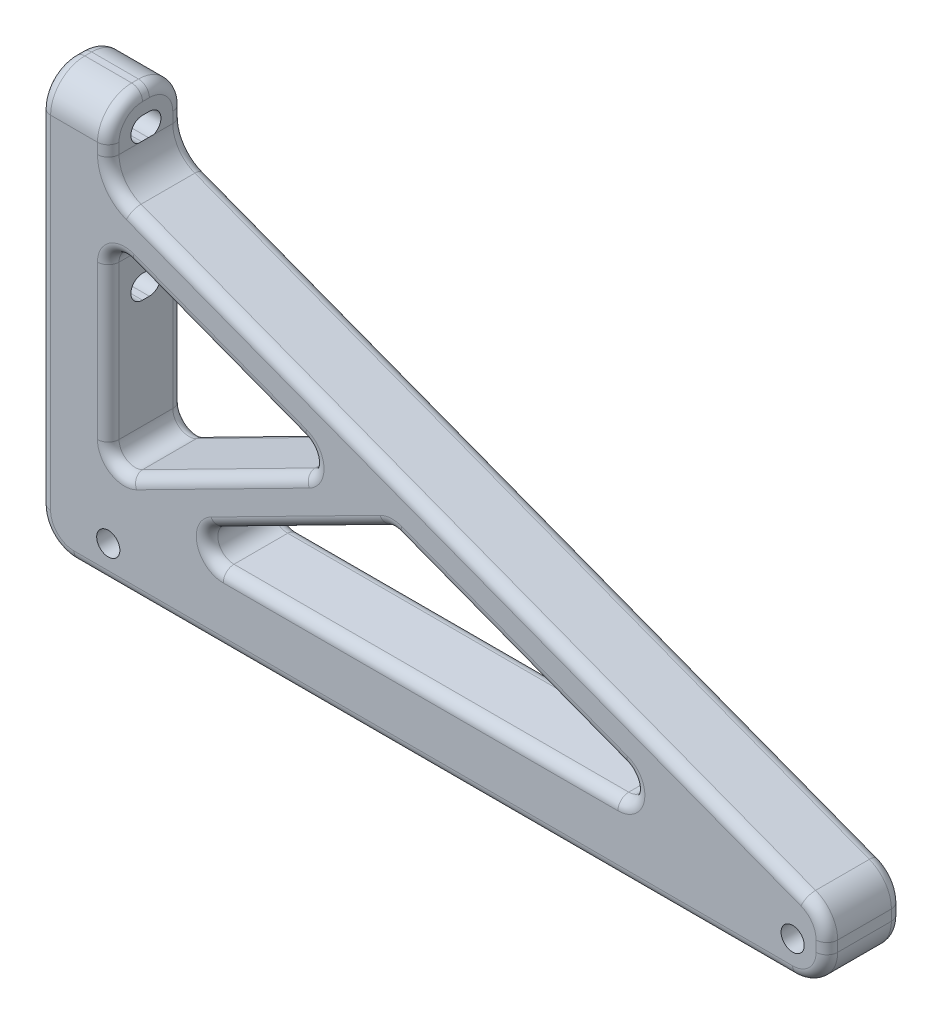
from build123d import *

# Parameters (mm, degrees)
SKETCH1_R           = 2.15
SKETCH1_W           = 12.7
SKETCH1_H           = 12.7
BOSS_EXTRUDE1_DEPTH = 13.97
FILLET1_R           = 3
FILLET2_R           = 6.35
CUT_EXTRUDE1_DEPTH  = 152.183351927
FILLET3_R           = 2
BOSS_EXTRUDE2_START = -13.97
SKETCH3_W           = 4.6228
SKETCH3_H           = 4.6228
BOSS_EXTRUDE2_DEPTH = 2
FILLET4_R           = 0.508


with BuildPart() as part:
    # Sketch1 → Boss-Extrude1 (new body)
    # profile 1 of 5: a face of its own
    with BuildSketch(Plane.XY):
        Polygon((0, 57.15), (-12.7, 57.15), (-12.7, -6.35), (133.35, -6.35), (133.35, 6.35), align=None)
        Circle(SKETCH1_R, mode=Mode.SUBTRACT)
        Polygon((0, 10.838020995), (0, 48.589159979), (42.42795548, 32.42612932), (47.471976934, 30.504597338), (52.515998389, 28.583065355), (110.877794946, 6.35), (8.820483578, 6.35), (0, 6.35), align=None, mode=Mode.SUBTRACT)
        with Locations((127, 0)):
            Circle(SKETCH1_R, mode=Mode.SUBTRACT)
    # profile 2 of 5: a face of its own
    with BuildSketch(Plane.XY):
        Polygon((133.35, 6.35), (0, 57.15), (-12.7, 57.15), (-12.7, -6.35), (133.35, -6.35), align=None)
        with Locations((127, 0)):
            Circle(SKETCH1_R, mode=Mode.SUBTRACT)
        Circle(SKETCH1_R, mode=Mode.SUBTRACT)
        Polygon((110.877794946, 6.35), (0, 48.589159979), (0, 6.35), align=None, mode=Mode.SUBTRACT)
    # profile 3 of 5: a face of its own
    with BuildSketch(Plane.XY):
        with Locations((-6.35, 63.5)):
            Rectangle(SKETCH1_W, SKETCH1_H)
    # profile 4 of 5: a face of its own
    with BuildSketch(Plane.XY):
        Polygon((42.42795548, 32.42612932), (0, 10.838020995), (0, 6.35), (47.471976934, 30.504597338), align=None)
    # profile 5 of 5: a face of its own
    with BuildSketch(Plane.XY):
        Polygon((47.471976934, 30.504597338), (0, 6.35), (8.820483578, 6.35), (52.515998389, 28.583065355), align=None)
    extrude(amount=BOSS_EXTRUDE1_DEPTH)

    # Fillet1
    fillet1_edges = [part.edges().sort_by_distance(p)[0] for p in [
        (52.515998389, 28.583065355, 6.985),
        (8.820483578, 6.35, 6.985),
        (110.877794946, 6.35, 6.985),
        (0, 48.589159979, 6.985),
        (0, 10.838020995, 6.985),
        (42.42795548, 32.42612932, 6.985),
    ]]
    fillet(fillet1_edges, radius=FILLET1_R)

    # Fillet2
    fillet2_edges = [part.edges().sort_by_distance(p)[0] for p in [
        (-6.35, 69.85, 0),
        (133.35, 6.35, 6.985),
        (133.35, -6.35, 6.985),
        (-12.7, -6.35, 6.985),
        (0, 57.15, 6.985),
        (-6.35, 69.85, 13.97),
    ]]
    fillet(fillet2_edges, radius=FILLET2_R)

    # Sketch2 → Cut-Extrude1 (cut, through all)
    with BuildSketch(Plane(origin=(0, 0, 0), x_dir=(0, 0, -1), z_dir=(1, 0, 0))):
        with BuildLine():
            Line((-7.62, 65.65), (-6.35, 65.65))
            ThreePointArc((-6.35, 65.65), (-4.2, 63.5), (-6.35, 61.35))
            Line((-6.35, 61.35), (-7.62, 61.35))
            ThreePointArc((-7.62, 61.35), (-9.77, 63.5), (-7.62, 65.65))
        make_face()
        with BuildLine():
            Line((-7.62, 35.95), (-6.35, 35.95))
            ThreePointArc((-6.35, 35.95), (-4.2, 38.1), (-6.35, 40.25))
            Line((-6.35, 40.25), (-7.62, 40.25))
            ThreePointArc((-7.62, 40.25), (-9.77, 38.1), (-7.62, 35.95))
        make_face()
    extrude(amount=-CUT_EXTRUDE1_DEPTH, mode=Mode.SUBTRACT)

    # Fillet3
    fillet3_edges = [part.edges().sort_by_distance(p)[0] for p in [
        (-12.7, 31.75, 13.97),
        (-12.7, 67.990128061, 12.110128061),
        (-12.7, 67.990128061, 1.859871939),
        (66.675, 31.75, 13.97),
        (60.325, -6.35, 13.97),
        (133.35, 0.986940426, 13.97),
        (132.22862896, 5.577204208, 13.97),
        (-10.840128061, -4.490128061, 13.97),
        (131.490128061, -4.490128061, 13.97),
        (1.12137104, 57.922795792, 0),
        (1.12137104, 57.922795792, 13.97),
        (57.953790951, 6.35, 0),
        (57.953790951, 6.35, 13.97),
        (74.701339099, 20.131506989, 0),
        (74.701339099, 20.131506989, 13.97),
        (35.65095639, 20.001828068, 0),
        (35.65095639, 20.001828068, 13.97),
        (0, 29.983239316, 0),
        (0, 29.983239316, 13.97),
        (20.378926173, 21.207185872, 0),
        (20.378926173, 21.207185872, 13.97),
        (20.086442529, 40.937181873, 0),
        (20.086442529, 40.937181873, 13.97),
        (97.526174762, 8.80704034, 0),
        (97.526174762, 8.80704034, 13.97),
        (52.531016852, 28.301819395, 0),
        (52.531016852, 28.301819395, 13.97),
        (18.414557487, 8.650483328, 0),
        (18.414557487, 8.650483328, 13.97),
        (1.431785869, 13.173010707, 0),
        (1.431785869, 13.173010707, 13.97),
        (38.032644918, 32.191420837, 0),
        (38.032644918, 32.191420837, 13.97),
        (1.297642509, 46.706206235, 0),
        (1.297642509, 46.706206235, 13.97),
        (66.675, 31.75, 0),
        (133.35, 0.986940426, 0),
        (60.325, -6.35, 0),
        (-12.7, 31.75, 0),
        (0, 62.513059574, 0),
        (132.22862896, 5.577204208, 0),
        (-10.840128061, -4.490128061, 0),
        (131.490128061, -4.490128061, 0),
        (0, 69.85, 6.985),
        (0, 62.513059574, 13.97),
        (0, 67.990128061, 12.110128061),
        (0, 67.990128061, 1.859871939),
        (-12.7, 69.85, 6.985),
    ]]
    fillet(fillet3_edges, radius=FILLET3_R)

    # Sketch3 → Boss-Extrude2 (add)
    with BuildSketch(Plane.XY.offset(13.97).offset(BOSS_EXTRUDE2_START)):
        with Locations((12.7, 0)):
            Rectangle(SKETCH3_W, SKETCH3_H)
        with Locations((114.3, 0)):
            Rectangle(SKETCH3_W, SKETCH3_H)
    extrude(amount=-BOSS_EXTRUDE2_DEPTH)

    # Fillet4
    fillet4_edges = [part.edges().sort_by_distance(p)[0] for p in [
        (15.0114, 0, -2),
        (15.0114, 2.3114, -1),
        (12.7, -2.3114, -2),
        (15.0114, -2.3114, -1),
        (10.3886, 0, -2),
        (10.3886, -2.3114, -1),
        (12.7, 2.3114, -2),
        (10.3886, 2.3114, -1),
        (116.6114, 0, -2),
        (116.6114, 2.3114, -1),
        (114.3, -2.3114, -2),
        (116.6114, -2.3114, -1),
        (111.9886, 0, -2),
        (111.9886, -2.3114, -1),
        (114.3, 2.3114, -2),
        (111.9886, 2.3114, -1),
    ]]
    fillet(fillet4_edges, radius=FILLET4_R)


solid = part.part
